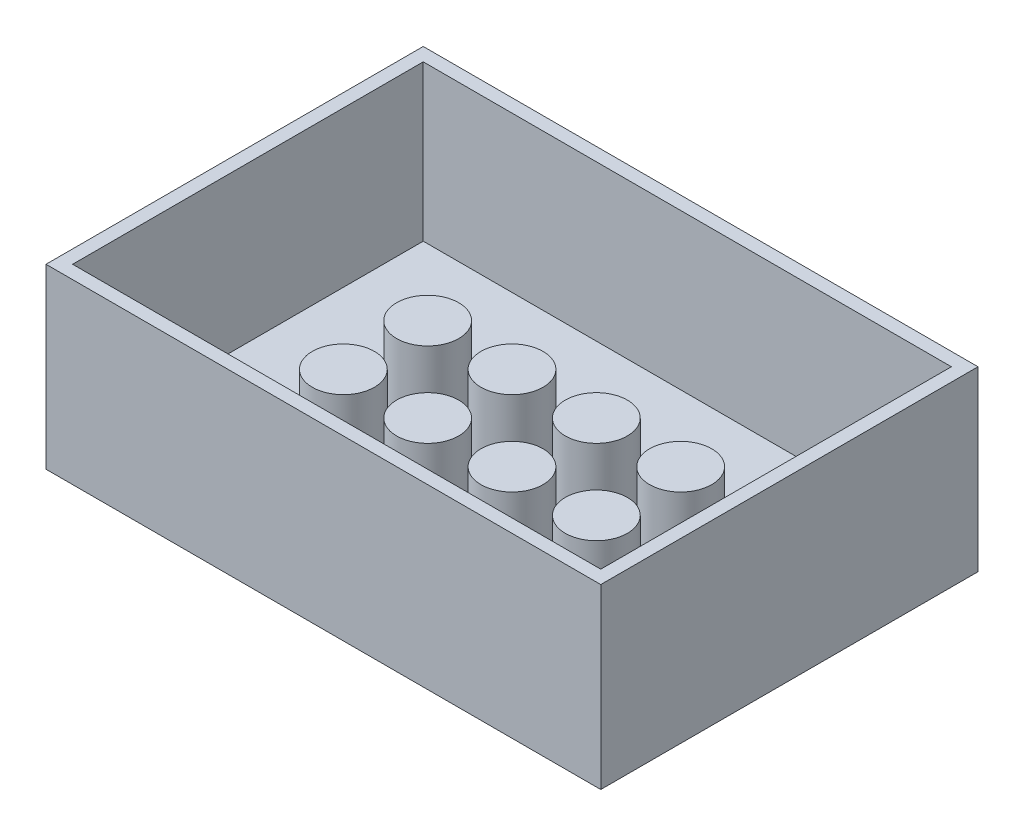
from build123d import *

# Parameters (mm, degrees)
SKETCH2_W            = 125
SKETCH2_H            = 85
CREATE_BEAM_DEPTH    = 40
SKETCH3_W            = 119
SKETCH3_H            = 79
SKETCH3_R            = 7
REMOVE_OUTSIDE_DEPTH = 35
SKETCH4_R            = 7
LOWER_PILLARS_DEPTH  = 20


with BuildPart() as part:
    # Sketch2 → Create Beam (new body)
    with BuildSketch(Plane(origin=(0, 0, 0), x_dir=(1, 0, 0), z_dir=(0, 1, 0))):
        with Locations((62.5, 42.5)):
            Rectangle(SKETCH2_W, SKETCH2_H)
    extrude(amount=CREATE_BEAM_DEPTH)

    # Sketch3 → Remove Outside (cut)
    with BuildSketch(Plane(origin=(0, 40, 0), x_dir=(1, 0, 0), z_dir=(0, 1, 0))):
        with Locations((62.5, 42.5)):
            Rectangle(SKETCH3_W, SKETCH3_H)
        with Locations(Location((91, 33, 0), (0, 0, 270))):
            Circle(SKETCH3_R, mode=Mode.SUBTRACT)
        with Locations(Location((72, 33, 0), (0, 0, 270))):
            Circle(SKETCH3_R, mode=Mode.SUBTRACT)
        with Locations(Location((53, 33, 0), (0, 0, 270))):
            Circle(SKETCH3_R, mode=Mode.SUBTRACT)
        with Locations(Location((34, 33, 0), (0, 0, 270))):
            Circle(SKETCH3_R, mode=Mode.SUBTRACT)
        with Locations(Location((91, 52, 0), (0, 0, 270))):
            Circle(SKETCH3_R, mode=Mode.SUBTRACT)
        with Locations(Location((72, 52, 0), (0, 0, 270))):
            Circle(SKETCH3_R, mode=Mode.SUBTRACT)
        with Locations(Location((53, 52, 0), (0, 0, 270))):
            Circle(SKETCH3_R, mode=Mode.SUBTRACT)
        with Locations(Location((34, 52, 0), (0, 0, 270))):
            Circle(SKETCH3_R, mode=Mode.SUBTRACT)
    extrude(amount=-REMOVE_OUTSIDE_DEPTH, mode=Mode.SUBTRACT)

    # Sketch4 → Lower Pillars (cut)
    with BuildSketch(Plane(origin=(0, 40, 0), x_dir=(1, 0, 0), z_dir=(0, 1, 0))):
        with Locations(Location((34, 33, 0), (0, 0, 270))):
            Circle(SKETCH4_R)
        with Locations(Location((53, 33, 0), (0, 0, 270))):
            Circle(SKETCH4_R)
        with Locations(Location((91, 33, 0), (0, 0, 270))):
            Circle(SKETCH4_R)
        with Locations(Location((72, 33, 0), (0, 0, 270))):
            Circle(SKETCH4_R)
        with Locations(Location((91, 52, 0), (0, 0, 270))):
            Circle(SKETCH4_R)
        with Locations(Location((72, 52, 0), (0, 0, 270))):
            Circle(SKETCH4_R)
        with Locations(Location((53, 52, 0), (0, 0, 270))):
            Circle(SKETCH4_R)
        with Locations(Location((34, 52, 0), (0, 0, 270))):
            Circle(SKETCH4_R)
    extrude(amount=-LOWER_PILLARS_DEPTH, mode=Mode.SUBTRACT)


solid = part.part
